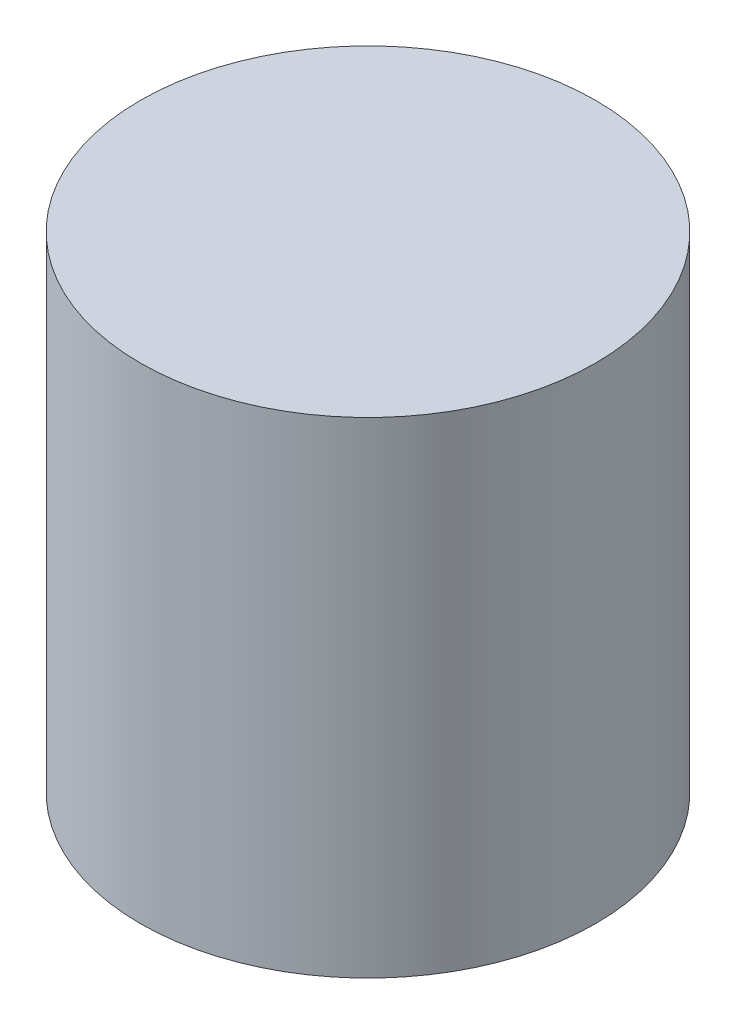
from build123d import *

# Parameters (mm, degrees)
SKETCH1_R           = 7.5
BOSS_EXTRUDE1_DEPTH = 16


with BuildPart() as part:
    # Sketch1 → Boss-Extrude1 (new body)
    with BuildSketch(Plane(origin=(0, 0, 0), x_dir=(1, 0, 0), z_dir=(0, 1, 0))):
        with Locations(Location((0, 0, 0), (0, 0, 270))):
            Circle(SKETCH1_R)
    extrude(amount=BOSS_EXTRUDE1_DEPTH)


solid = part.part
